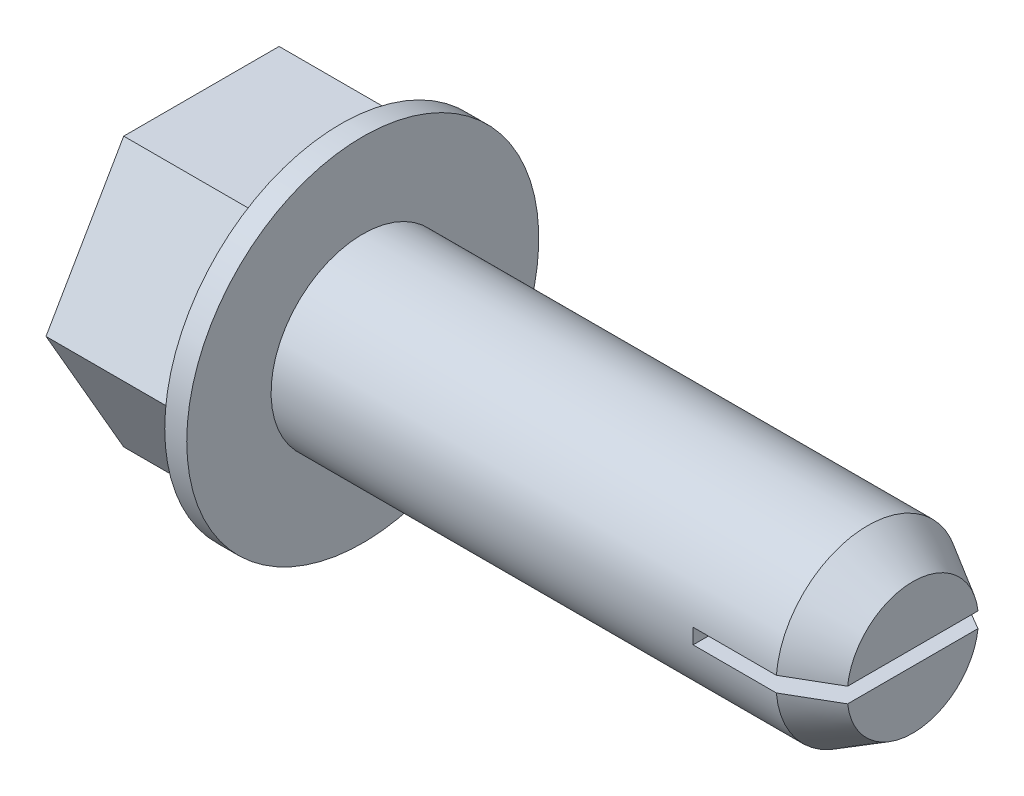
from build123d import *
from OCP.BRepFilletAPI import BRepFilletAPI_MakeChamfer

# Parameters (mm, degrees)
SKETCH1_R           = 6.096
BOSS_EXTRUDE1_DEPTH = 0.762
SKETCH2_R           = 3.175
BOSS_EXTRUDE2_DEPTH = 19.05
CUT_EXTRUDE1_START  = -4.445
CUT_EXTRUDE1_DEPTH  = 4.445
BOSS_EXTRUDE3_DEPTH = 4.445
BOSS_EXTRUDE4_DEPTH = 4.826
HOLE1_D             = 7.45744
HOLE1_DEPTH         = 0.9652
CHAMFER1_SIZE       = 0.9017
CHAMFER1_SIZE2      = 1.561790213


with BuildPart() as part:
    # Sketch1 → Boss-Extrude1 (new body)
    with BuildSketch(Plane(origin=(-0.762, 0, 0), x_dir=(0, -1, 0), z_dir=(-1, 0, 0))):
        with Locations(Location((0, 0, 0), (0, 0, 90))):
            Circle(SKETCH1_R)
    extrude(amount=-BOSS_EXTRUDE1_DEPTH)

    # Sketch2 → Boss-Extrude2 (add)
    with BuildSketch(Plane(origin=(0, 0, 0), x_dir=(0, 0, -1), z_dir=(1, 0, 0))):
        with Locations(Location((0, 0, 0), (0, 0, 180))):
            Circle(SKETCH2_R)
    extrude(amount=BOSS_EXTRUDE2_DEPTH)

    # Sketch3 → Cut-Extrude1 (cut)
    with BuildSketch(Plane(origin=(19.05, 0, 0), x_dir=(0, 0, -1), z_dir=(1, 0, 0)).offset(CUT_EXTRUDE1_START)):
        with BuildLine():
            Line((-3.163956488, -0.264583333), (3.163956488, -0.264583333))
            ThreePointArc((3.163956488, -0.264583333), (0, 3.175), (-3.163956488, -0.264583333))
        make_face()
    extrude(amount=CUT_EXTRUDE1_DEPTH, mode=Mode.SUBTRACT)

    # Sketch4 → Boss-Extrude3 (add)
    with BuildSketch(Plane(origin=(14.605, 0, 0), x_dir=(0, 0, -1), z_dir=(1, 0, 0))):
        with BuildLine():
            Line((3.163956488, 0.264583333), (-3.163956488, 0.264583333))
            ThreePointArc((-3.163956488, 0.264583333), (0, 3.175), (3.163956488, 0.264583333))
        make_face()
    extrude(amount=BOSS_EXTRUDE3_DEPTH)

    # Sketch5 → Boss-Extrude4 (add)
    with BuildSketch(Plane.ZY.offset(0.762)):
        Polygon((-2.69097187, -4.6609), (-5.381943739, 0), (-2.69097187, 4.6609), (2.69097187, 4.6609), (5.381943739, 0), (2.69097187, -4.6609), align=None)
    extrude(amount=BOSS_EXTRUDE4_DEPTH)

    # Hole1
    with Locations(Plane.ZY.offset(5.588)):
        with Locations((0, 0)):
            Hole(HOLE1_D / 2, depth=HOLE1_DEPTH)

    # Chamfer1: one chamfer whose edges measure the first distance from different faces: ONE call of the kernel's chamfer builder (chamfer() names one face for all edges)
    chamfer1_edges_1 = [part.edges().sort_by_distance(p)[0] for p in [
        (19.05, 3.175, 0),
    ]]
    chamfer1_side_1 = [part.faces().sort_by_distance(p)[0] for p in [
        (19.05, 1.491577602, 0),
    ]]
    chamfer1_edges_2 = [part.edges().sort_by_distance(p)[0] for p in [
        (19.05, -3.175, 0),
    ]]
    chamfer1_side_2 = [part.faces().sort_by_distance(p)[0] for p in [
        (19.05, -1.491577602, 0),
    ]]
    chamfer1 = BRepFilletAPI_MakeChamfer(part.part.solid().wrapped)
    for e in chamfer1_edges_1:
        chamfer1.Add(CHAMFER1_SIZE, CHAMFER1_SIZE2, e.wrapped, chamfer1_side_1[0].wrapped)  # the first distance lies on this face
    for e in chamfer1_edges_2:
        chamfer1.Add(CHAMFER1_SIZE, CHAMFER1_SIZE2, e.wrapped, chamfer1_side_2[0].wrapped)  # the first distance lies on this face
    add(Compound.cast(chamfer1.Shape()), mode=Mode.REPLACE)


solid = part.part
